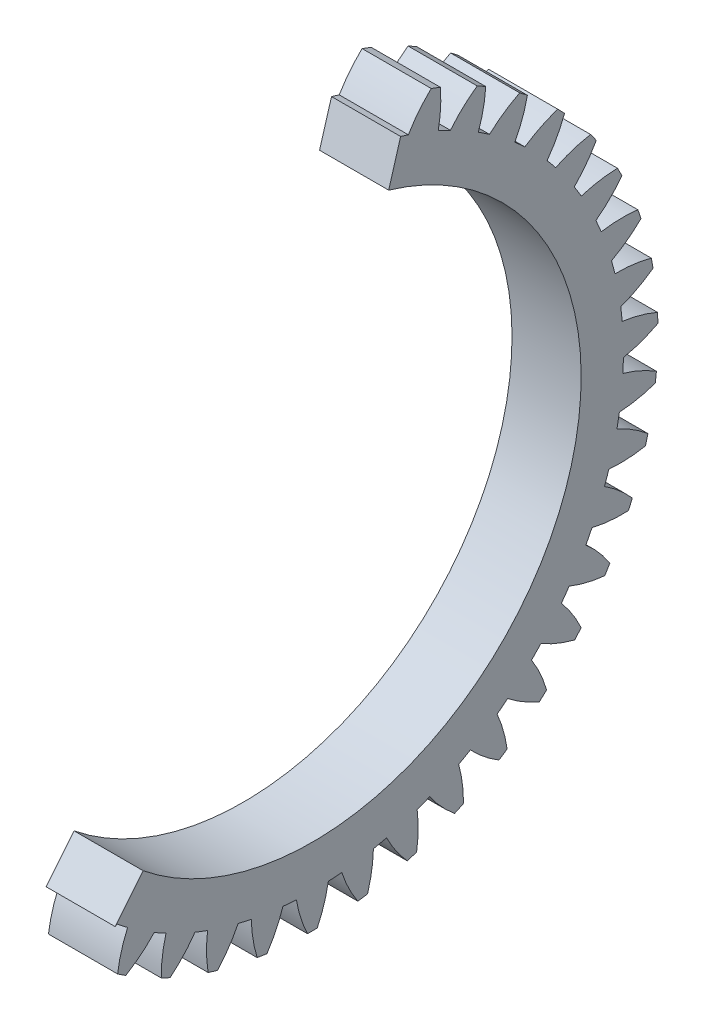
from build123d import *

# Parameters (mm, degrees)
BASPROSKE_W                = 9
BASPROSKE_H                = 45
TOOTHCUT_DEPTH             = 65.272855857
TEETHCUTS_COUNT            = 43
TEETHCUTS_ANGLE            = 351.627906977
BORSKE_R                   = 3
BORE_DEPTH                 = 50.0000508
WYTNIJ_WYCI_GNI_CIE1_DEPTH = 65.265003825


with BuildPart() as part:
    # BasProSke → Base-Revolve (revolve)
    with BuildSketch(Plane(origin=(0, 0, 0), x_dir=(1, 0, 0), z_dir=(0, 1, 0)), mode=Mode.PRIVATE) as base_revolve_sk:
        with Locations((4.5, 22.5)):
            Rectangle(BASPROSKE_W, BASPROSKE_H)
    revolve(base_revolve_sk.sketch.rotate(Axis((-10, 0, 0), (1, 0, 0)), 180), axis=Axis((-10, 0, 0), (1, 0, 0)))

    # TooCutSke → ToothCut (cut, through all)
    with BuildSketch(Plane(origin=(0, 0, 0), x_dir=(0, 0, -1), z_dir=(1, 0, 0))):
        with BuildLine():
            ThreePointArc((0.875138877, 40.489543501), (0, 40.499), (-0.875138877, 40.489543501))
            ThreePointArc((-0.875138877, 40.489543501), (-1.611840844, 42.780747503), (-2.66114443, 44.94669015))
            ThreePointArc((-2.66114443, 44.94669015), (0, 45.0254), (2.66114443, 44.94669015))
            ThreePointArc((2.66114443, 44.94669015), (1.611840844, 42.780747503), (0.875138877, 40.489543501))
        make_face()
    toothcut = extrude(amount=TOOTHCUT_DEPTH, mode=Mode.SUBTRACT)

    # TeethCuts: ToothCut ×43 about axis
    teethcuts_axis = Axis((-10, 0, 0), (1, 0, 0))
    for i in range(1, TEETHCUTS_COUNT):
        add(toothcut.rotate(teethcuts_axis, i * TEETHCUTS_ANGLE / (TEETHCUTS_COUNT - 1)), mode=Mode.SUBTRACT)

    # BorSke → Bore (cut, symmetric)
    with BuildSketch(Plane(origin=(0, 0, 0), x_dir=(0, 0, -1), z_dir=(1, 0, 0))):
        with Locations(Location((0, 0, 0), (0, 0, 180))):
            Circle(BORSKE_R)
    extrude(amount=BORE_DEPTH, both=True, mode=Mode.SUBTRACT)

    # Szkic2 → Wytnij-wyciągnięcie1 (cut, through all)
    with BuildSketch(Plane(origin=(0, 0, 0), x_dir=(0, 0, -1), z_dir=(1, 0, 0))):
        with BuildLine():
            Line((-31.467717921, -38.8559227), (-22.027402545, -27.19914589))
            ThreePointArc((-22.027402545, -27.19914589), (30.975282492, -16.295148804), (9.936124572, 33.559997445))
            Line((9.936124572, 33.559997445), (14.194463674, 47.942853492))
            ThreePointArc((14.194463674, 47.942853492), (-44.25040356, 23.278784006), (-31.467717921, -38.8559227))
        make_face()
    extrude(amount=WYTNIJ_WYCI_GNI_CIE1_DEPTH, mode=Mode.SUBTRACT)


solid = part.part
